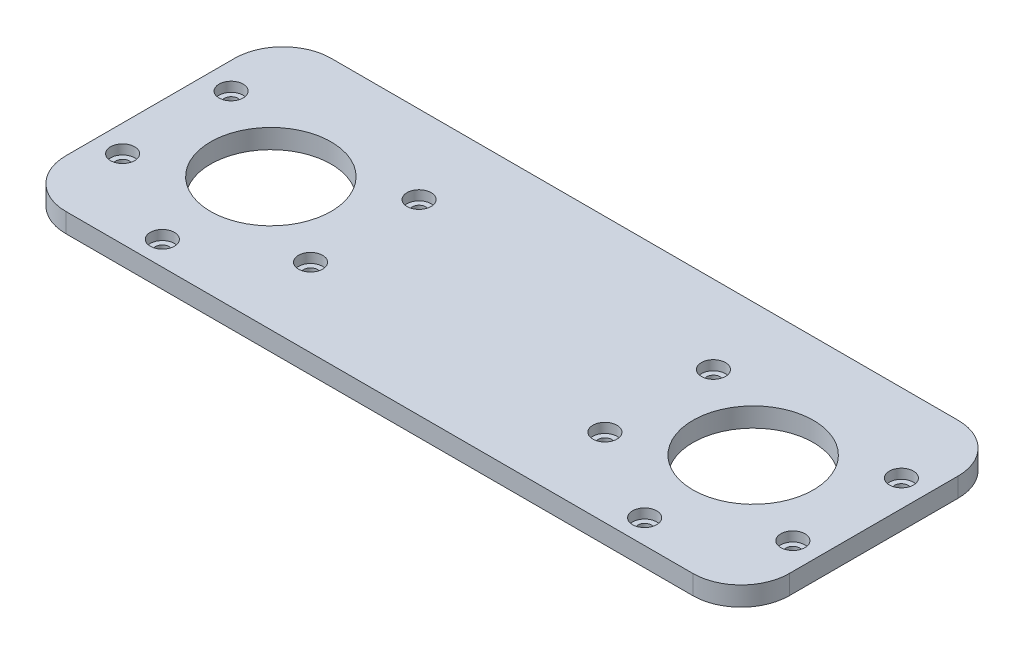
from build123d import *

# Parameters (mm, degrees)
SKETCH1_W           = 150
SKETCH1_H           = 55
SKETCH1_R           = 12.5
BOSS_EXTRUDE1_DEPTH = 4
SKETCH2_R           = 1.4
CUT_EXTRUDE1_DEPTH  = 80.982810653
SKETCH3_R           = 2.5
CUT_EXTRUDE3_DEPTH  = 2
FILLET1_R           = 10


with BuildPart() as part:
    # Sketch1 → Boss-Extrude1 (new body)
    with BuildSketch(Plane(origin=(0, 0, 0), x_dir=(1, 0, 0), z_dir=(0, 1, 0))):
        Rectangle(SKETCH1_W, SKETCH1_H)
        with Locations(Location((-50, 0, 0), (0, 0, 270))):
            Circle(SKETCH1_R, mode=Mode.SUBTRACT)
        with Locations(Location((50, 0, 0), (0, 0, 270))):
            Circle(SKETCH1_R, mode=Mode.SUBTRACT)
    extrude(amount=BOSS_EXTRUDE1_DEPTH)

    # Sketch2 → Cut-Extrude1 (cut, through all)
    with BuildSketch(Plane(origin=(0, 4, 0), x_dir=(1, 0, 0), z_dir=(0, 1, 0))):
        with Locations(Location((30.514428415, 11.25, 0), (0, 0, 270))):
            Circle(SKETCH2_R)
        with Locations(Location((69.485571585, 11.25, 0), (0, 0, 270))):
            Circle(SKETCH2_R)
        with Locations(Location((69.485571585, -11.25, 0), (0, 0, 270))):
            Circle(SKETCH2_R)
        with Locations(Location((30.514428415, -11.25, 0), (0, 0, 270))):
            Circle(SKETCH2_R)
        with Locations(Location((50, -22.5, 0), (0, 0, 270))):
            Circle(SKETCH2_R)
    cut_extrude1 = extrude(amount=-CUT_EXTRUDE1_DEPTH, mode=Mode.SUBTRACT)

    # Sketch3 → Cut-Extrude3 (cut)
    with BuildSketch(Plane(origin=(0, 4, 0), x_dir=(1, 0, 0), z_dir=(0, 1, 0))):
        with Locations(Location((30.514428415, 11.25, 0), (0, 0, 270))):
            Circle(SKETCH3_R)
        with Locations(Location((30.514428415, -11.25, 0), (0, 0, 270))):
            Circle(SKETCH3_R)
        with Locations(Location((50, -22.5, 0), (0, 0, 270))):
            Circle(SKETCH3_R)
        with Locations(Location((69.485571585, -11.25, 0), (0, 0, 270))):
            Circle(SKETCH3_R)
        with Locations(Location((69.485571585, 11.25, 0), (0, 0, 270))):
            Circle(SKETCH3_R)
    cut_extrude3 = extrude(amount=-CUT_EXTRUDE3_DEPTH, mode=Mode.SUBTRACT)

    # Mirror1: Cut-Extrude1, Cut-Extrude3 across plane
    add(cut_extrude1.mirror(Plane(origin=(0, 0, 0), x_dir=(0, 0, 1), z_dir=(1, 0, 0))), mode=Mode.SUBTRACT)
    add(cut_extrude3.mirror(Plane(origin=(0, 0, 0), x_dir=(0, 0, 1), z_dir=(1, 0, 0))), mode=Mode.SUBTRACT)

    # Fillet1
    fillet1_edges = [part.edges().sort_by_distance(p)[0] for p in [
        (-75, 2, -27.5),
        (75, 2, -27.5),
        (75, 2, 27.5),
        (-75, 2, 27.5),
    ]]
    fillet(fillet1_edges, radius=FILLET1_R)


solid = part.part
